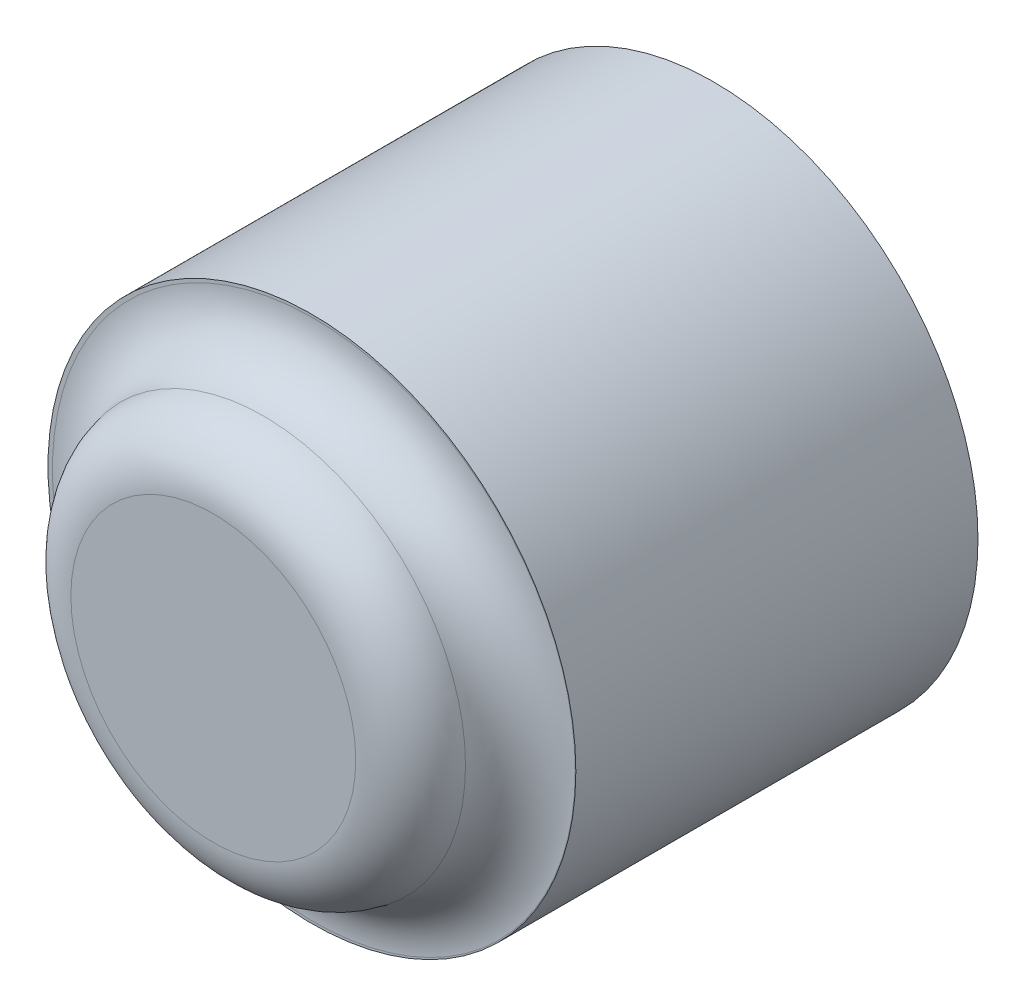
from build123d import *

# Parameters (mm, degrees)
SKETCH1_R           = 5.25
BOSS_EXTRUDE1_DEPTH = 8
SKETCH2_R           = 4
BOSS_EXTRUDE2_DEPTH = 2
FILLET2_R           = 1.2
FILLET3_R           = 1.2


with BuildPart() as part:
    # Sketch1 → Boss-Extrude1 (new body)
    with BuildSketch(Plane.XY):
        with Locations((0, 174.50846383)):
            Circle(SKETCH1_R)
    extrude(amount=BOSS_EXTRUDE1_DEPTH)

    # Sketch2 → Boss-Extrude2 (add)
    with BuildSketch(Plane.XY.offset(8)):
        with Locations((0.038551533, 174.508746935)):
            Circle(SKETCH2_R)
    extrude(amount=BOSS_EXTRUDE2_DEPTH)

    # Fillet2
    fillet2_edges = [part.edges().sort_by_distance(p)[0] for p in [
        (-3.961448467, 174.508746935, 8),
    ]]
    fillet(fillet2_edges, radius=FILLET2_R)

    # Fillet3
    fillet3_edges = [part.edges().sort_by_distance(p)[0] for p in [
        (-3.961448467, 174.508746935, 10),
    ]]
    fillet(fillet3_edges, radius=FILLET3_R)


solid = part.part
